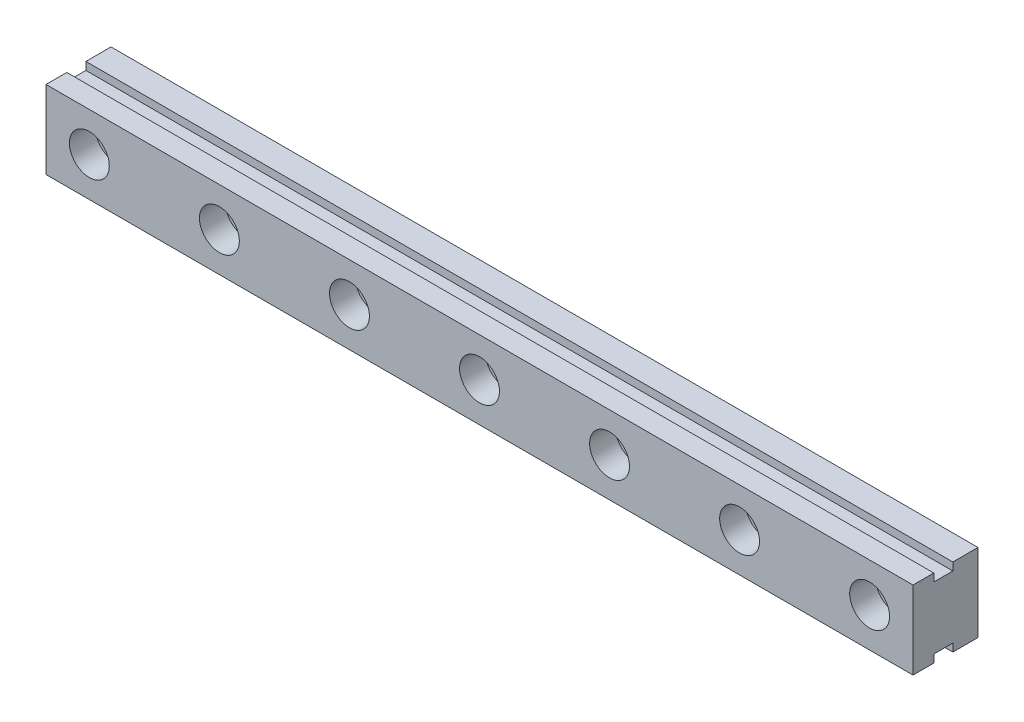
from build123d import *

# Parameters (mm, degrees)
F_100_START                            = 27.5
F_100_MM_RAIL_BLANK_PROFILE_W          = 100
F_100_MM_RAIL_BLANK_PROFILE_H          = 9
F_100_MM_RAIL_BLANK_DEPTH              = 7.5
LONGITUDINAL_START                     = 30.4
LONGITUDINAL_RUNNING_GROOVES_PROFILE_W = 100.2
LONGITUDINAL_RUNNING_GROOVES_PROFILE_H = 1.4
LONGITUDINAL_RUNNING_GROOVES_DEPTH     = 2.2
RAIL_START                             = 27.4
RAIL_BOLT_CLEARANCE_PROFILE_R          = 1.35
RAIL_BOLT_CLEARANCE_DEPTH              = 7.8
RAIL_START_2                           = 32
RAIL_HEAD_RECESSES_PROFILE_R           = 2.3
RAIL_HEAD_RECESSES_DEPTH               = 3.2


with BuildPart() as part:
    # 100 mm rail blank profile → 100 mm rail blank (new body)
    with BuildSketch(Plane.XY.offset(F_100_START)):
        with Locations((33, 18.5)):
            Rectangle(F_100_MM_RAIL_BLANK_PROFILE_W, F_100_MM_RAIL_BLANK_PROFILE_H)
    extrude(amount=F_100_MM_RAIL_BLANK_DEPTH)

    # Longitudinal running grooves profile → Longitudinal running grooves (cut)
    with BuildSketch(Plane.XY.offset(LONGITUDINAL_START)):
        with Locations((33, 14.2)):
            Rectangle(LONGITUDINAL_RUNNING_GROOVES_PROFILE_W, LONGITUDINAL_RUNNING_GROOVES_PROFILE_H)
        with Locations((33, 22.8)):
            Rectangle(LONGITUDINAL_RUNNING_GROOVES_PROFILE_W, LONGITUDINAL_RUNNING_GROOVES_PROFILE_H)
    extrude(amount=LONGITUDINAL_RUNNING_GROOVES_DEPTH, mode=Mode.SUBTRACT)

    # Rail bolt clearance profile → Rail bolt clearance (cut)
    with BuildSketch(Plane.XY.offset(RAIL_START)):
        with Locations((-12, 18.5)):
            Circle(RAIL_BOLT_CLEARANCE_PROFILE_R)
        with Locations((3, 18.5)):
            Circle(RAIL_BOLT_CLEARANCE_PROFILE_R)
        with Locations((18, 18.5)):
            Circle(RAIL_BOLT_CLEARANCE_PROFILE_R)
        with Locations((33, 18.5)):
            Circle(RAIL_BOLT_CLEARANCE_PROFILE_R)
        with Locations((48, 18.5)):
            Circle(RAIL_BOLT_CLEARANCE_PROFILE_R)
        with Locations((63, 18.5)):
            Circle(RAIL_BOLT_CLEARANCE_PROFILE_R)
        with Locations((78, 18.5)):
            Circle(RAIL_BOLT_CLEARANCE_PROFILE_R)
    extrude(amount=RAIL_BOLT_CLEARANCE_DEPTH, mode=Mode.SUBTRACT)

    # Rail head recesses profile → Rail head recesses (cut)
    with BuildSketch(Plane.XY.offset(RAIL_START_2)):
        with Locations((-12, 18.5)):
            Circle(RAIL_HEAD_RECESSES_PROFILE_R)
        with Locations((3, 18.5)):
            Circle(RAIL_HEAD_RECESSES_PROFILE_R)
        with Locations((18, 18.5)):
            Circle(RAIL_HEAD_RECESSES_PROFILE_R)
        with Locations((33, 18.5)):
            Circle(RAIL_HEAD_RECESSES_PROFILE_R)
        with Locations((48, 18.5)):
            Circle(RAIL_HEAD_RECESSES_PROFILE_R)
        with Locations((63, 18.5)):
            Circle(RAIL_HEAD_RECESSES_PROFILE_R)
        with Locations((78, 18.5)):
            Circle(RAIL_HEAD_RECESSES_PROFILE_R)
    extrude(amount=RAIL_HEAD_RECESSES_DEPTH, mode=Mode.SUBTRACT)


solid = part.part
